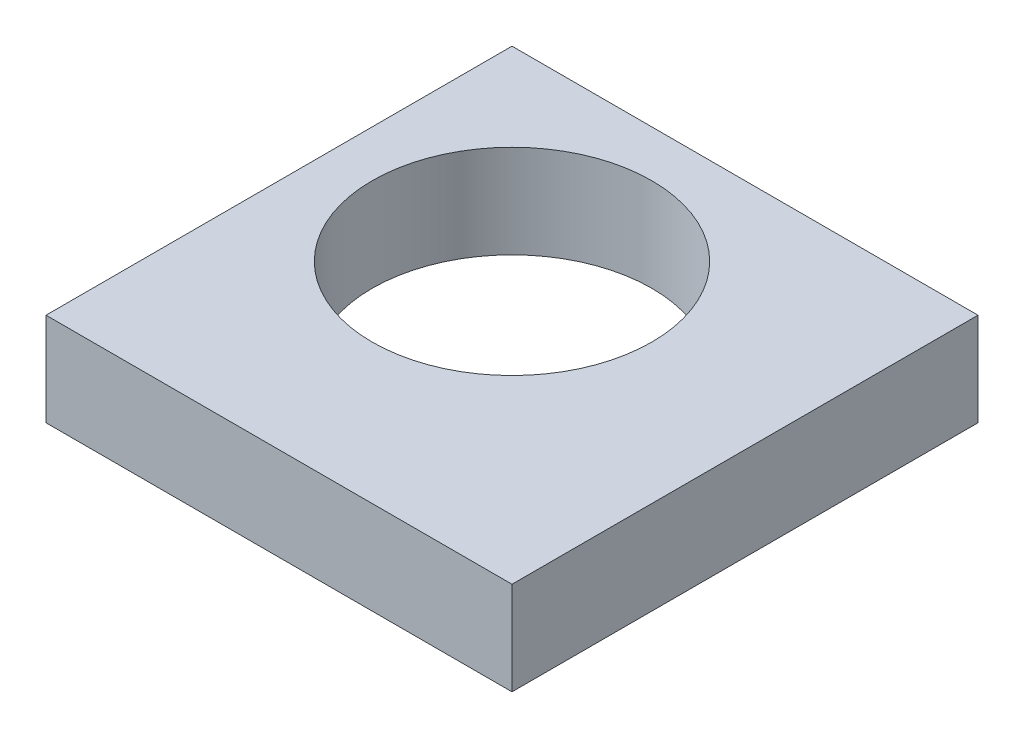
from build123d import *

# Parameters (mm, degrees)
SKETCH1_W           = 50
SKETCH1_H           = 50
BOSS_EXTRUDE1_DEPTH = 10
SKETCH3_R           = 15
CUT_EXTRUDE1_DEPTH  = 10


with BuildPart() as part:
    # Sketch1 → Boss-Extrude1 (new body)
    with BuildSketch(Plane(origin=(0, 0, 0), x_dir=(1, 0, 0), z_dir=(0, 1, 0))):
        Rectangle(SKETCH1_W, SKETCH1_H)
    extrude(amount=BOSS_EXTRUDE1_DEPTH)

    # Sketch3 → Cut-Extrude1 (cut)
    with BuildSketch(Plane(origin=(0, 10, 0), x_dir=(1, 0, 0), z_dir=(0, 1, 0))):
        with Locations(Location((-5, 5, 0), (0, 0, 270))):
            Circle(SKETCH3_R)
    extrude(amount=-CUT_EXTRUDE1_DEPTH, mode=Mode.SUBTRACT)


solid = part.part
